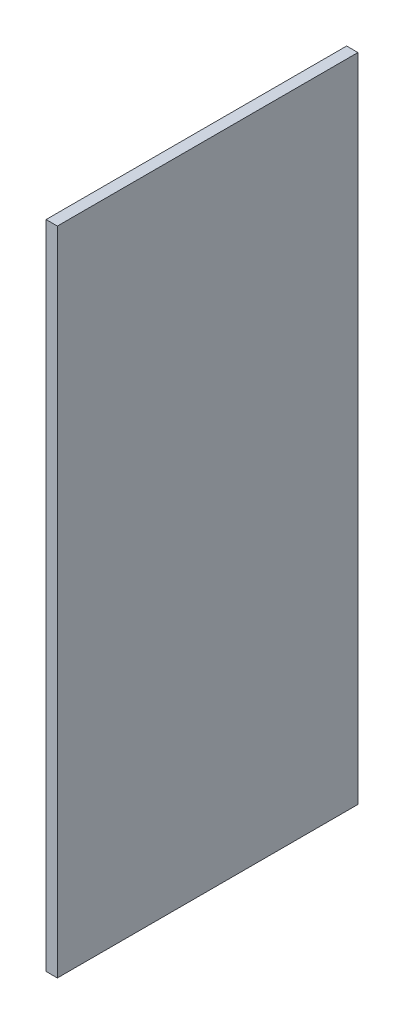
from build123d import *

# Parameters (mm, degrees)
OVEN_YALITIM_TASYUNU_SOL_1_START = -20
SKETCH1_W                        = 30
SKETCH1_H                        = 1730
OVEN_YALITIM_TASYUNU_SOL_1_DEPTH = 798.5


with BuildPart() as part:
    # Sketch1 → OVEN_yalitim_tasyunu_sol_1 (new body)
    with BuildSketch(Plane.XY.offset(OVEN_YALITIM_TASYUNU_SOL_1_START)):
        with Locations((16.5, 985)):
            Rectangle(SKETCH1_W, SKETCH1_H)
    extrude(amount=-OVEN_YALITIM_TASYUNU_SOL_1_DEPTH)


solid = part.part
